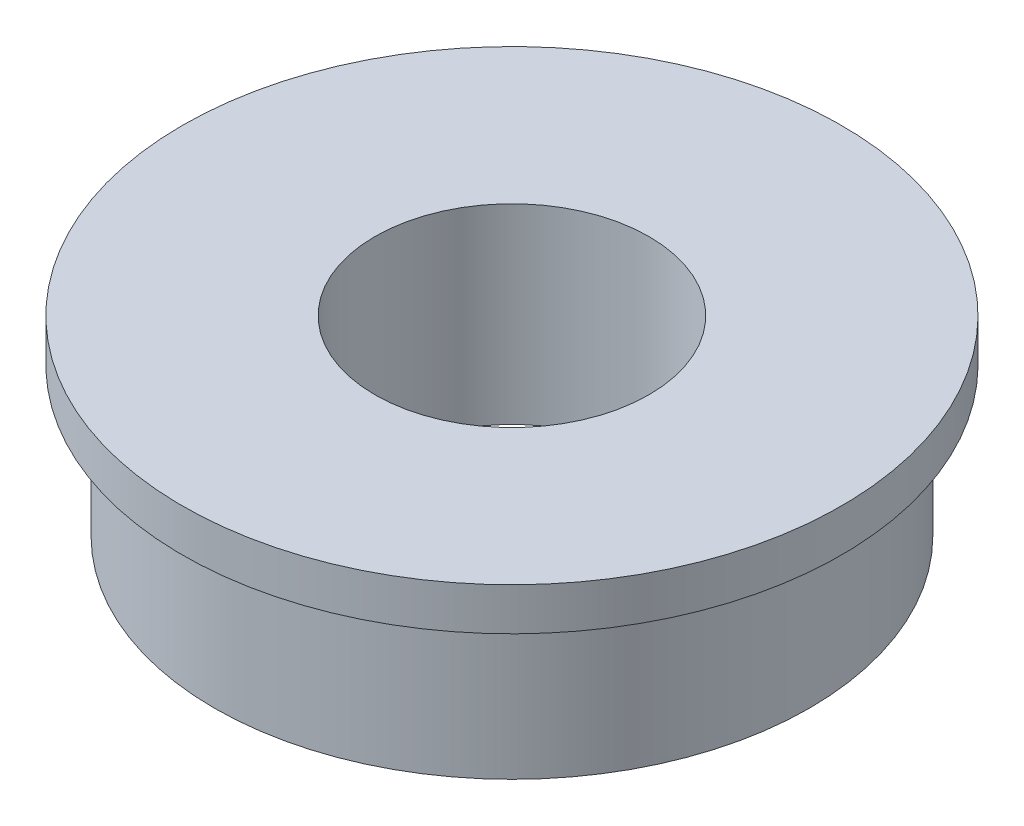
from build123d import *

# Parameters (mm, degrees)
ROUND_CORTE_DEPTH      = 18.765856553
ROUND_CORTE_DEPTH_BACK = 18.765856553
CROQUIS3_R             = 5.1181


with BuildPart() as part:
    # Croquis2 → Revolución1 (revolve)
    with BuildSketch(Plane.XY):
        Polygon((0, 3.5687), (0, -3.5687), (-11.1125, -3.5687), (-11.1125, 1.9812), (-12.3063, 1.9812), (-12.3063, 3.5687), align=None)
    revolve(axis=Axis((0, 3.5687, 0), (0, -1, 0)))

    # Croquis3 → Round Corte (cut, two sides: drawn at the far end of the back side and taken through both)
    with BuildSketch(Plane(origin=(0, 0, 0), x_dir=(1, 0, 0), z_dir=(0, 1, 0)).offset(-ROUND_CORTE_DEPTH_BACK)):
        with Locations(Location((0, 0, 0), (0, 0, 270))):
            Circle(CROQUIS3_R)
    extrude(amount=ROUND_CORTE_DEPTH + ROUND_CORTE_DEPTH_BACK, mode=Mode.SUBTRACT)


solid = part.part
